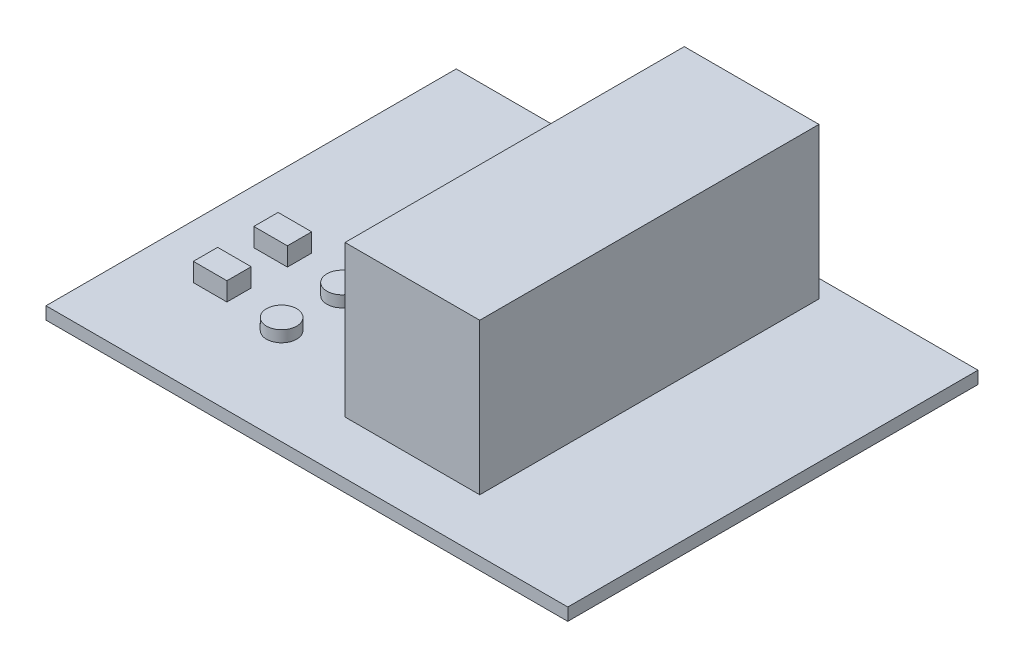
from build123d import *

# Parameters (mm, degrees)
SKETCH1_W           = 69.03
SKETCH1_H           = 54.27
BOSS_EXTRUDE1_DEPTH = 1.65
SKETCH2_R           = 2
BOSS_EXTRUDE2_DEPTH = 1.5
SKETCH3_W           = 4.44
SKETCH3_H           = 3.21
BOSS_EXTRUDE3_DEPTH = 2.44
SKETCH4_W           = 17.82
SKETCH4_H           = 44.88
BOSS_EXTRUDE4_DEPTH = 20


with BuildPart() as part:
    # Sketch1 → Boss-Extrude1 (new body)
    with BuildSketch(Plane(origin=(0, 0, 0), x_dir=(1, 0, 0), z_dir=(0, 1, 0))):
        Rectangle(SKETCH1_W, SKETCH1_H)
    extrude(amount=BOSS_EXTRUDE1_DEPTH)

    # Sketch2 → Boss-Extrude2 (add)
    with BuildSketch(Plane(origin=(0, 1.65, 0), x_dir=(1, 0, 0), z_dir=(0, 1, 0))):
        with Locations(Location((-16.095, -14.385, 0), (0, 0, 90))):
            Circle(SKETCH2_R)
        with Locations(Location((-16.095, -6.385, 0), (0, 0, 90))):
            Circle(SKETCH2_R)
    extrude(amount=BOSS_EXTRUDE2_DEPTH)

    # Sketch3 → Boss-Extrude3 (add)
    with BuildSketch(Plane(origin=(0, 1.65, 0), x_dir=(1, 0, 0), z_dir=(0, 1, 0))):
        with Locations((-25.195, -13.135)):
            Rectangle(SKETCH3_W, SKETCH3_H)
        with Locations((-25.195, -5.135)):
            Rectangle(SKETCH3_W, SKETCH3_H)
    extrude(amount=BOSS_EXTRUDE3_DEPTH)

    # Sketch4 → Boss-Extrude4 (add)
    with BuildSketch(Plane(origin=(0, 1.65, 0), x_dir=(1, 0, 0), z_dir=(0, 1, 0))):
        with Locations((6.925, 2.335)):
            Rectangle(SKETCH4_W, SKETCH4_H)
    extrude(amount=BOSS_EXTRUDE4_DEPTH)


solid = part.part
